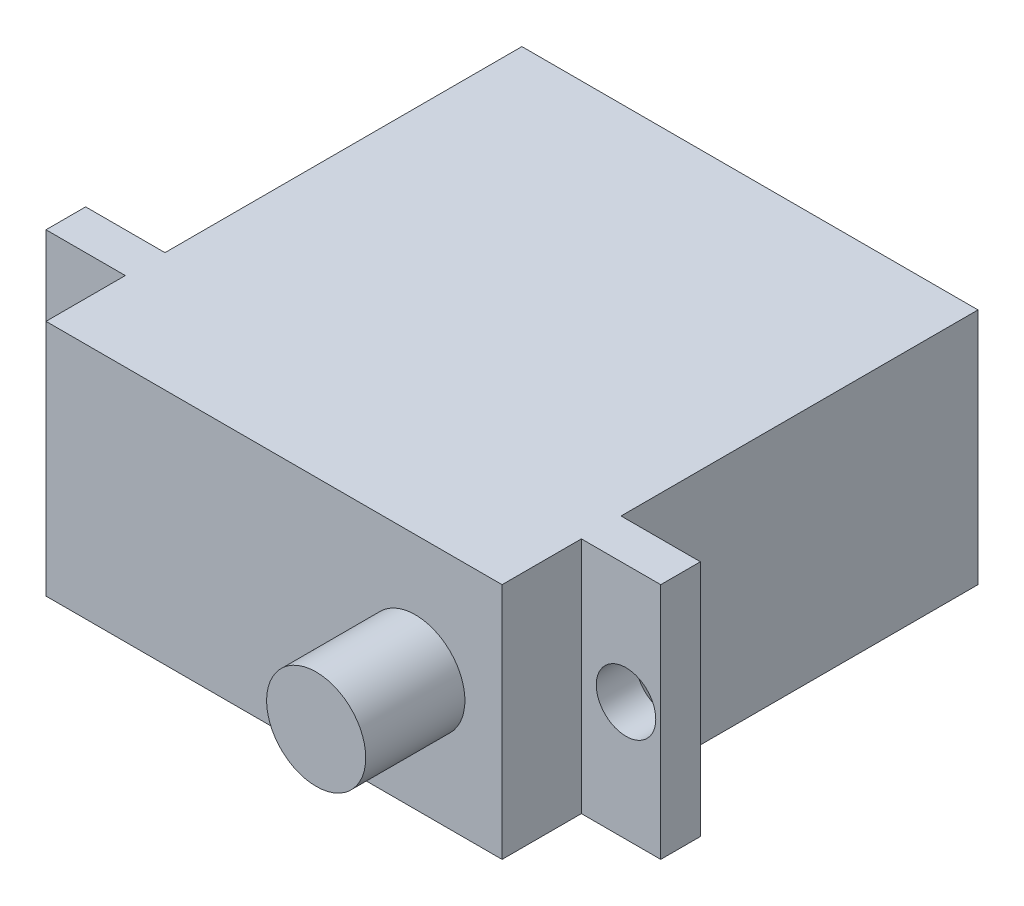
from build123d import *

# Parameters (mm, degrees)
SKETCH_1_W      = 23
SKETCH_1_H      = 12
EXTRUDE_1_DEPTH = 20
SKETCH_2_W      = 4
SKETCH_2_H      = 12
SKETCH_2_R      = 1.5
EXTRUDE_2_DEPTH = 2
SKETCH_3_W      = 23
SKETCH_3_H      = 12
EXTRUDE_3_DEPTH = 4
SKETCH_4_R      = 2.5
EXTRUDE_4_DEPTH = 5


with BuildPart() as part:
    # 草图1 → 凸台-拉伸1 (new body)
    with BuildSketch(Plane.XY):
        with Locations((11.5, 6)):
            Rectangle(SKETCH_1_W, SKETCH_1_H)
    extrude(amount=EXTRUDE_1_DEPTH)

    # 草图2 → 凸台-拉伸2 (add)
    # profile 1 of 2: a face of its own
    with BuildSketch(Plane.XY.offset(20)):
        with Locations((-2, 6)):
            Rectangle(SKETCH_2_W, SKETCH_2_H)
        with Locations((-2.25, 6)):
            Circle(SKETCH_2_R, mode=Mode.SUBTRACT)
    # profile 2 of 2: a face of its own
    with BuildSketch(Plane.XY.offset(20)):
        with Locations((25, 6)):
            Rectangle(SKETCH_2_W, SKETCH_2_H)
        with Locations((25.25, 6)):
            Circle(SKETCH_2_R, mode=Mode.SUBTRACT)
    extrude(amount=-EXTRUDE_2_DEPTH)

    # 草图3 → 凸台-拉伸3 (add)
    with BuildSketch(Plane.XY.offset(20)):
        with Locations((11.5, 6)):
            Rectangle(SKETCH_3_W, SKETCH_3_H)
    extrude(amount=EXTRUDE_3_DEPTH)

    # 草图4 → 凸台-拉伸4 (add)
    with BuildSketch(Plane.XY.offset(24)):
        with Locations(Location((18.623805867, 6, 0), (0, 0, 180))):
            Circle(SKETCH_4_R)
    extrude(amount=EXTRUDE_4_DEPTH)


solid = part.part
